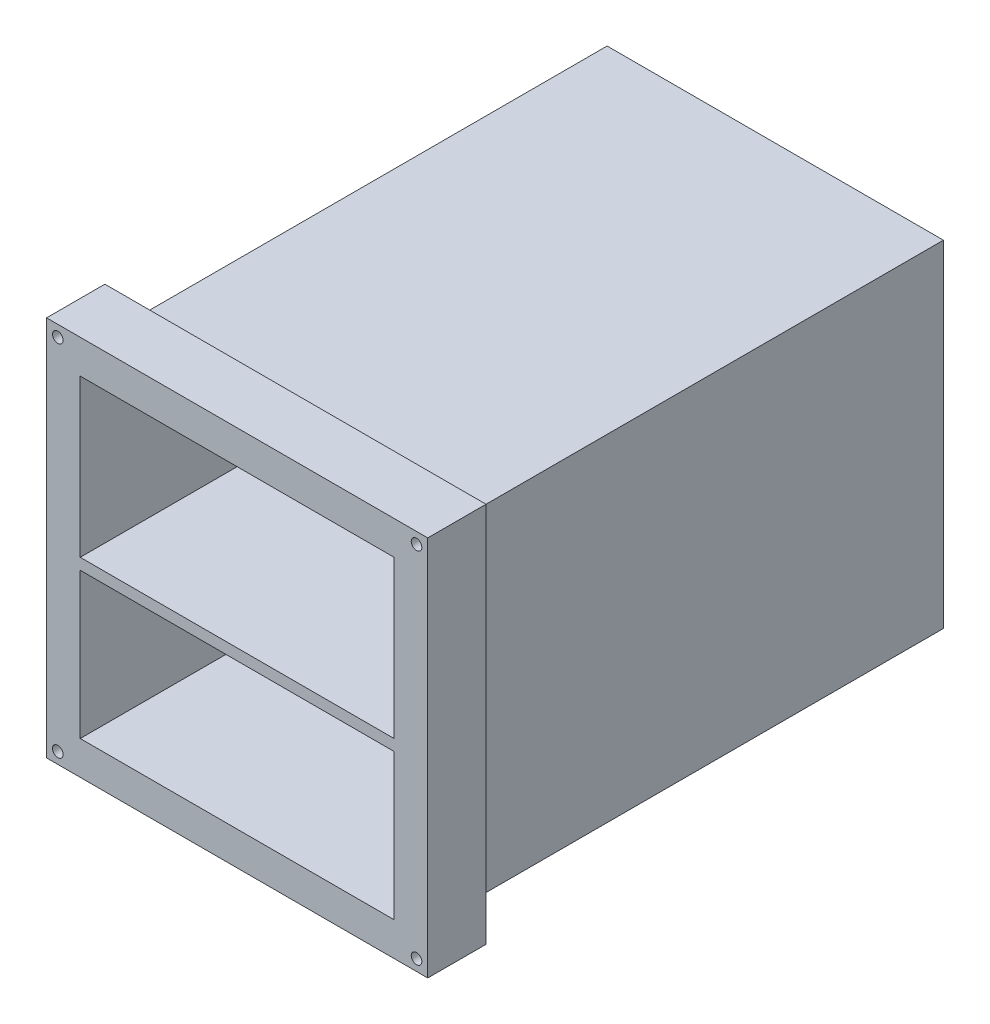
from build123d import *

# Parameters (mm, degrees)
SKETCH1_W           = 95.25
SKETCH1_H           = 95.25
BOSS_EXTRUDE1_DEPTH = 152.4
SKETCH2_W           = 88.9
SKETCH2_H           = 44.45
CUT_EXTRUDE1_DEPTH  = 139.7
SKETCH2_3_W         = 88.9
SKETCH2_3_H         = 41.275
CUT_EXTRUDE2_DEPTH  = 111.76
SKETCH5_W           = 107.95
SKETCH5_H           = 107.95
SKETCH5_W_2         = 88.9
SKETCH5_H_2         = 88.9
BOSS_EXTRUDE2_DEPTH = 16.51
SKETCH6_R           = 1.5
CUT_EXTRUDE5_DEPTH  = 16.51
SKETCH7_R           = 1.5
CUT_EXTRUDE6_DEPTH  = 7.874
CUT_EXTRUDE7_DEPTH  = 30.48
SKETCH8_W           = 32.09515361
SKETCH8_H           = 4.475150354
CUT_EXTRUDE8_DEPTH  = 30.48


with BuildPart() as part:
    # Sketch1 → Boss-Extrude1 (new body)
    with BuildSketch(Plane.XY):
        Rectangle(SKETCH1_W, SKETCH1_H)
    extrude(amount=BOSS_EXTRUDE1_DEPTH)

    # Sketch2 → Cut-Extrude1 (cut)
    with BuildSketch(Plane.XY.offset(152.4)):
        with Locations((0, 22.225)):
            Rectangle(SKETCH2_W, SKETCH2_H)
    extrude(amount=-CUT_EXTRUDE1_DEPTH, mode=Mode.SUBTRACT)

    # Sketch2<3> → Cut-Extrude2 (cut)
    with BuildSketch(Plane.XY.offset(152.4)):
        with Locations((0, -23.8125)):
            Rectangle(SKETCH2_3_W, SKETCH2_3_H)
    extrude(amount=-CUT_EXTRUDE2_DEPTH, mode=Mode.SUBTRACT)

    # Sketch5 → Boss-Extrude2 (add)
    with BuildSketch(Plane.XY.offset(152.4)):
        Rectangle(SKETCH5_W, SKETCH5_H)
        Rectangle(SKETCH5_W_2, SKETCH5_H_2, mode=Mode.SUBTRACT)
    extrude(amount=-BOSS_EXTRUDE2_DEPTH)

    # Sketch6 → Cut-Extrude5 (cut)
    with BuildSketch(Plane.XY.offset(152.4)):
        with Locations((-50.8, 50.8)):
            Circle(SKETCH6_R)
        with Locations((50.8, 50.8)):
            Circle(SKETCH6_R)
        with Locations((-50.8, -50.8)):
            Circle(SKETCH6_R)
        with Locations((50.8, -50.8)):
            Circle(SKETCH6_R)
    extrude(amount=-CUT_EXTRUDE5_DEPTH, mode=Mode.SUBTRACT)

    # Sketch7 → Cut-Extrude6 (cut)
    with BuildSketch(Plane(origin=(0, 0, 0), x_dir=(-1, 0, 0), z_dir=(0, 0, -1))):
        with Locations((-44.45, 0.987495031)):
            Circle(SKETCH7_R)
        with Locations((44.45, 0.987495031)):
            Circle(SKETCH7_R)
        with Locations((44.45, -42.992427459)):
            Circle(SKETCH7_R)
        with Locations((-44.45, -42.992427459)):
            Circle(SKETCH7_R)
    extrude(amount=-CUT_EXTRUDE6_DEPTH, mode=Mode.SUBTRACT)

    # Sketch3 → Cut-Extrude7 (cut)
    with BuildSketch(Plane(origin=(0, 0, 0), x_dir=(-1, 0, 0), z_dir=(0, 0, -1))):
        Polygon((41.787446397, -3.204523257), (-42.032553603, -3.204523257), (-42.032553603, -31.144523257), (-32.415427886, -31.144523257), (-32.415427886, -43.844523257), (32.415427886, -43.844523257), (32.415427886, -31.144523257), (41.787446397, -31.144523257), align=None)
    extrude(amount=-CUT_EXTRUDE7_DEPTH, mode=Mode.SUBTRACT)

    # Sketch8 → Cut-Extrude8 (cut)
    with BuildSketch(Plane(origin=(0, 0, 30.48), x_dir=(-1, 0, 0), z_dir=(0, 0, -1))):
        with Locations((0, -41.60694808)):
            Rectangle(SKETCH8_W, SKETCH8_H)
    extrude(amount=-CUT_EXTRUDE8_DEPTH, mode=Mode.SUBTRACT)


solid = part.part
